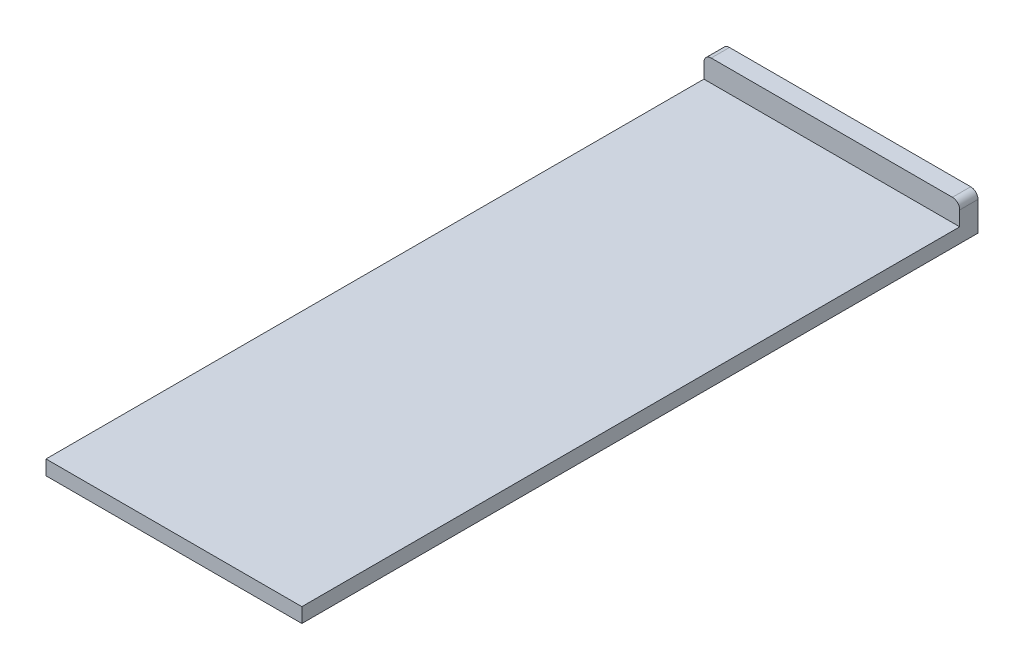
from build123d import *

# Parameters (mm, degrees)
SLIDING_DOOR_HOLDER_DEPTH = 6.35
SKETCH1_5_W               = 88.9
SKETCH1_5_H               = 5.08
SLIDING_DOOR_DEPTH        = 234.95


with BuildPart() as part:
    # Sliding Door Sketch → Sliding Door Holder (new body)
    with BuildSketch(Plane.XY):
        with BuildLine():
            Line((-44.91175508, 0.127), (43.98824492, 0.127))
            Line((43.98824492, 0.127), (43.98824492, 10.287))
            ThreePointArc((43.98824492, 10.287), (43.244296144, 12.083051224), (41.44824492, 12.827))
            Line((41.44824492, 12.827), (-42.37175508, 12.827))
            ThreePointArc((-42.37175508, 12.827), (-44.167806304, 12.083051224), (-44.91175508, 10.287))
            Line((-44.91175508, 10.287), (-44.91175508, 0.127))
        make_face()
    extrude(amount=SLIDING_DOOR_HOLDER_DEPTH)

    # Sketch1<5> → Sliding Door (add)
    with BuildSketch(Plane.XY):
        with Locations((-0.46175508, 2.667)):
            Rectangle(SKETCH1_5_W, SKETCH1_5_H)
    extrude(amount=SLIDING_DOOR_DEPTH)


solid = part.part
